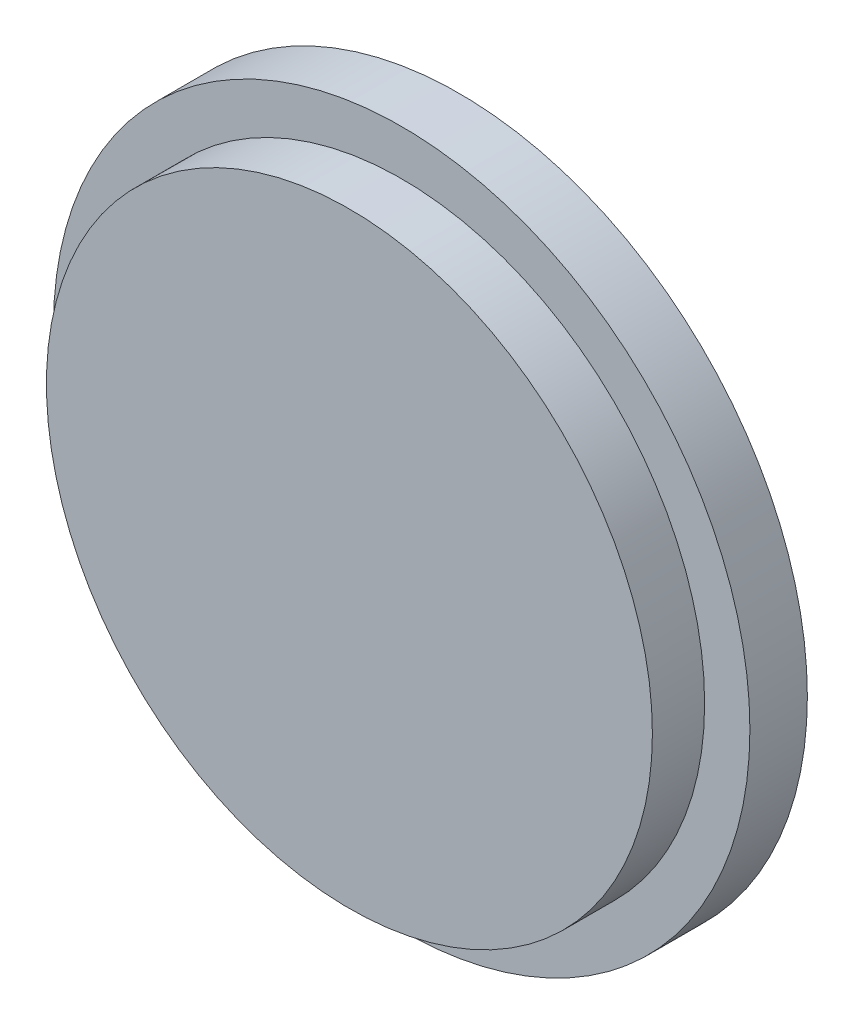
from build123d import *

# Parameters (mm, degrees)
SKETCH_1_R      = 20
SKETCH_1_R_2    = 17.4
EXTRUDE_1_DEPTH = 3.3
SKETCH_1_2_R    = 17.4
EXTRUDE_2_DEPTH = 6.3


with BuildPart() as part:
    # 草图1 → 凸台-拉伸1 (new body)
    with BuildSketch(Plane.XY):
        Circle(SKETCH_1_R)
        Circle(SKETCH_1_R_2, mode=Mode.SUBTRACT)
    extrude(amount=EXTRUDE_1_DEPTH)

    # 草图1<2> → 凸台-拉伸2 (add)
    with BuildSketch(Plane.XY):
        Circle(SKETCH_1_2_R)
    extrude(amount=EXTRUDE_2_DEPTH)


solid = part.part
